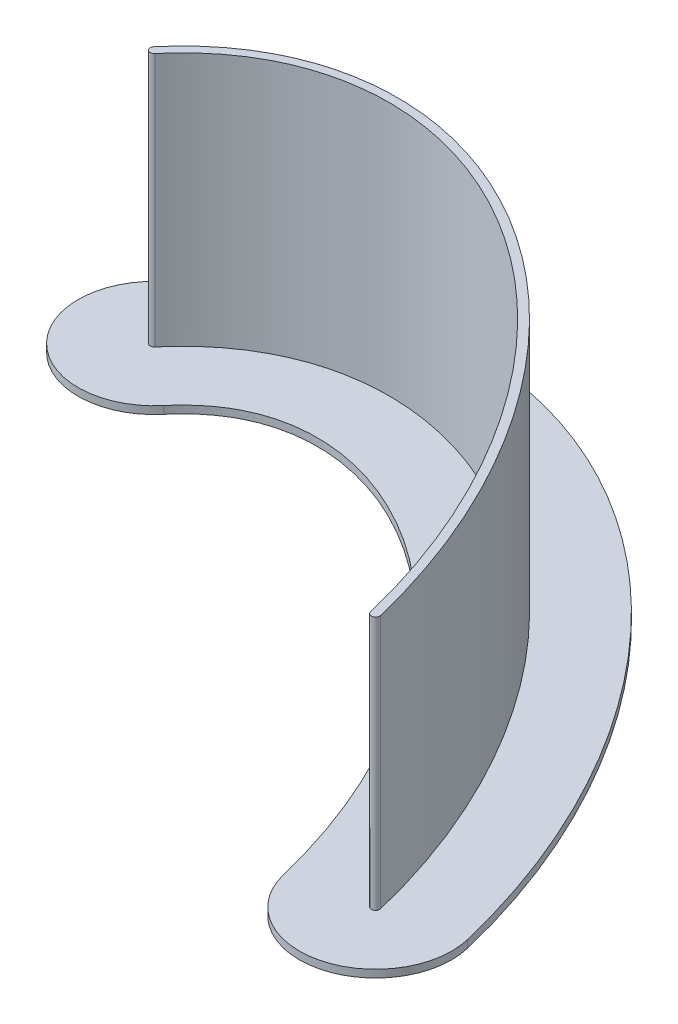
from build123d import *

# Parameters (mm, degrees)
ASPA_DEPTH          = 100
BOSS_EXTRUDE1_DEPTH = 3


with BuildPart() as part:
    # Sketch1 → Aspa (new body)
    with BuildSketch(Plane(origin=(0, 0, 0), x_dir=(1, 0, 0), z_dir=(0, 1, 0))):
        with BuildLine():
            ThreePointArc((25.447793126, 0.386570406), (24.230286438, -1.604077093), (22.239638939, -0.386570406))
            add(Edge.make_bspline(
                [(22.239638939, -0.386570406), (21.757478048, 1.614160196), (20.749121719, 5.597302334), (18.536030085, 13.574591529), (14.168694774, 27.479743189), (6.550840337, 47.079936231), (-4.628442304, 69.734907552), (-21.975568559, 98.239463115), (-47.651343304, 129.677792921), (-82.591872401, 157.938934972), (-112.981407164, 171.898903888), (-136.706178937, 176.753073489), (-153.882706061, 177.19977096), (-170.139849975, 174.457544689), (-182.693050278, 169.564346219), (-192.015134762, 164.134990799), (-198.616330487, 159.32363019), (-203.771296986, 154.710229964), (-207.666830265, 150.676861459), (-209.548220456, 148.533756447), (-210.459571896, 147.44572479)],
                knots=[1.285391812, 1.285391812, 1.285391812, 1.285391812, 1.319128815, 1.352865818, 1.420339824, 1.555287836, 1.690235848, 1.82518386, 2.095079884, 2.364975908, 2.634871932, 2.769819944, 2.904767956, 3.039715967, 3.174663979, 3.242137985, 3.309611991, 3.377085997, 3.410823, 3.444560003, 3.444560003, 3.444560003, 3.444560003], degree=3))
            ThreePointArc((-210.459571896, 147.44572479), (-212.783966565, 147.240324157), (-212.989367198, 149.564718827))
            add(Edge.make_bspline(
                [(25.447793126, 0.386570406), (24.469423216, 4.446324434), (22.333224695, 12.496143625), (17.278981997, 28.592037716), (9.575585068, 48.408864531), (-1.732113789, 71.325665764), (-19.282855172, 100.164756936), (-45.285499338, 132.010247367), (-80.787938764, 160.741243667), (-111.866153701, 175.039124584), (-136.310465657, 180.046556902), (-154.101500744, 180.513328396), (-171.016980761, 177.663303296), (-184.108550637, 172.560778181), (-193.824522276, 166.901653535), (-200.696906081, 161.892236402), (-206.053892172, 157.097615744), (-210.09605989, 152.912239242), (-212.044923282, 150.692258471), (-212.989367198, 149.564718827)],
                knots=[1.285391812, 1.285391812, 1.285391812, 1.285391812, 1.352865818, 1.420339824, 1.555287836, 1.690235848, 1.82518386, 2.095079884, 2.364975908, 2.634871932, 2.769819944, 2.904767956, 3.039715967, 3.174663979, 3.242137985, 3.309611991, 3.377085997, 3.410823, 3.444560003, 3.444560003, 3.444560003, 3.444560003], degree=3))
        make_face()
    extrude(amount=ASPA_DEPTH)

    # Sketch1<6> → Boss-Extrude1 (add)
    with BuildSketch(Plane(origin=(0, 0, 0), x_dir=(1, 0, 0), z_dir=(0, 1, 0))):
        with BuildLine():
            ThreePointArc((53.008754094, 7.028552828), (30.87226886, -29.165038062), (-5.321322029, -7.028552828))
            add(Edge.make_bspline(
                [(-5.321322029, -7.028552828), (-5.752950613, -5.237506451), (-6.655037469, -1.674110926), (-8.6398779, 5.480878278), (-11.443110905, 14.40659541), (-15.310525869, 25.045167991), (-21.110443607, 39.04951786), (-29.511654733, 56.07370943), (-45.107779267, 81.696632202), (-67.97631331, 109.640843996), (-98.089242139, 133.864294121), (-122.562455739, 144.921585832), (-140.105714345, 148.459050781), (-152.003061212, 148.733301905), (-162.60449903, 146.917163479), (-170.532615395, 143.822271696), (-176.470851118, 140.366842739), (-180.742294705, 137.256967741), (-184.161729253, 134.200415757), (-186.797539391, 131.472934141), (-188.099273447, 129.990261782), (-188.726330433, 129.241639658)],
                knots=[1.285391812, 1.285391812, 1.285391812, 1.285391812, 1.319128815, 1.352865818, 1.420339824, 1.48781383, 1.555287836, 1.690235848, 1.82518386, 2.095079884, 2.364975908, 2.634871932, 2.769819944, 2.904767956, 3.039715967, 3.174663979, 3.242137985, 3.309611991, 3.377085997, 3.410823, 3.444560003, 3.444560003, 3.444560003, 3.444560003], degree=3))
            ThreePointArc((-188.726330433, 129.241639658), (-230.988051698, 125.507082694), (-234.722608661, 167.768803959))
            add(Edge.make_bspline(
                [(53.008754094, 7.028552828), (51.929817399, 11.505609563), (49.571841508, 20.39092904), (44.012354136, 38.093264581), (35.556422664, 59.844015849), (23.1511521, 84.986891525), (3.849324765, 116.707571722), (-24.960519687, 152.047203238), (-65.290568749, 184.815877475), (-102.285114039, 202.016459154), (-132.910914262, 208.340551294), (-155.981206852, 208.979905408), (-178.552102656, 205.203280991), (-199.813171225, 196.924192445), (-215.737282567, 186.496778707), (-227.077525578, 176.342226424), (-232.269234058, 170.69780491), (-234.722608661, 167.768803959)],
                knots=[1.285391812, 1.285391812, 1.285391812, 1.285391812, 1.352865818, 1.420339824, 1.555287836, 1.690235848, 1.82518386, 2.095079884, 2.364975908, 2.634871932, 2.769819944, 2.904767956, 3.039715967, 3.174663979, 3.309611991, 3.377085997, 3.444560003, 3.444560003, 3.444560003, 3.444560003], degree=3))
        make_face()
    extrude(amount=-BOSS_EXTRUDE1_DEPTH)


solid = part.part
